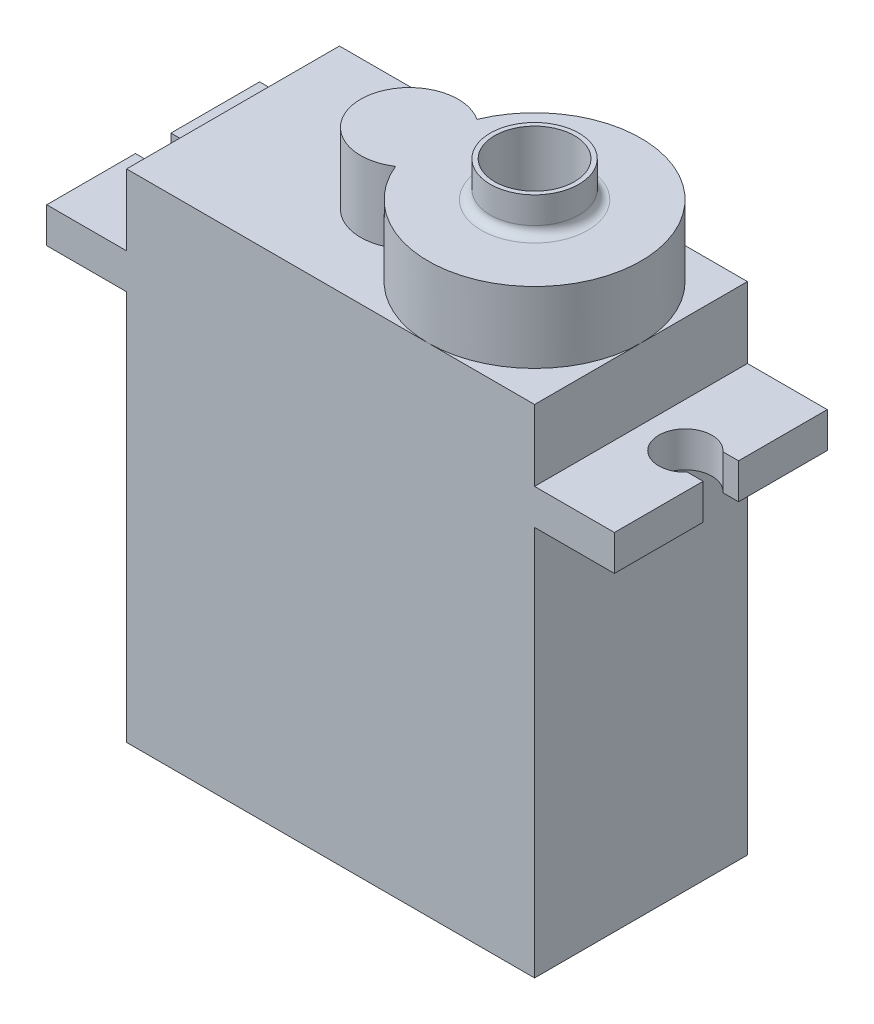
from build123d import *

# Parameters (mm, degrees)
SKETCH1_W           = 23
SKETCH1_H           = 12
BOSS_EXTRUDE1_DEPTH = 22
SKETCH2_W           = 32
SKETCH2_H           = 12
BOSS_EXTRUDE2_DEPTH = 2
CUT_EXTRUDE1_DEPTH  = 5
SKETCH3_W           = 23
SKETCH3_H           = 12
BOSS_EXTRUDE4_DEPTH = 4
BOSS_EXTRUDE5_DEPTH = 4
SKETCH6_R           = 2.5
SKETCH6_R_2         = 2.25
BOSS_EXTRUDE6_DEPTH = 2
CUT_EXTRUDE2_START  = -4
SKETCH7_R           = 2.25
CUT_EXTRUDE2_DEPTH  = 4
FILLET4_R           = 0.5
SKETCH8_R           = 2.25
BOSS_EXTRUDE7_DEPTH = 1
SKETCH9_R           = 0.75
BOSS_EXTRUDE8_DEPTH = 2


with BuildPart() as part:
    # Sketch1 → Boss-Extrude1 (new body)
    with BuildSketch(Plane(origin=(0, 0, 0), x_dir=(1, 0, 0), z_dir=(0, 1, 0))):
        Rectangle(SKETCH1_W, SKETCH1_H)
    extrude(amount=BOSS_EXTRUDE1_DEPTH)

    # Sketch2 → Boss-Extrude2 (add)
    with BuildSketch(Plane(origin=(0, 22, 0), x_dir=(1, 0, 0), z_dir=(0, 1, 0))):
        Rectangle(SKETCH2_W, SKETCH2_H)
    extrude(amount=BOSS_EXTRUDE2_DEPTH)

    # Sketch4 → Cut-Extrude1 (cut)
    with BuildSketch(Plane(origin=(0, 24, 0), x_dir=(1, 0, 0), z_dir=(0, 1, 0))):
        with BuildLine():
            Line((-16.63954717, 1), (-15.118033989, 1))
            ThreePointArc((-15.118033989, 1), (-12.5, 0), (-15.118033989, -1))
            Line((-15.118033989, -1), (-16.63954717, -1))
            Line((-16.63954717, -1), (-16.63954717, 1))
        make_face()
        with BuildLine():
            Line((15.118033989, 1), (17.121315796, 1))
            Line((17.121315796, 1), (17.121315796, -1))
            Line((17.121315796, -1), (15.118033989, -1))
            ThreePointArc((15.118033989, -1), (12.5, 0), (15.118033989, 1))
        make_face()
    extrude(amount=-CUT_EXTRUDE1_DEPTH, mode=Mode.SUBTRACT)

    # Sketch3 → Boss-Extrude4 (add)
    with BuildSketch(Plane(origin=(0, 24, 0), x_dir=(1, 0, 0), z_dir=(0, 1, 0))):
        Rectangle(SKETCH3_W, SKETCH3_H)
    extrude(amount=BOSS_EXTRUDE4_DEPTH)

    # Sketch5 → Boss-Extrude5 (add)
    with BuildSketch(Plane(origin=(0, 28, 0), x_dir=(1, 0, 0), z_dir=(0, 1, 0))):
        with BuildLine():
            ThreePointArc((-0.043232592, -2.296208273), (11.5, 0), (-0.043232592, 2.296208273))
            ThreePointArc((-0.043232592, 2.296208273), (-4.306483254, 0), (-0.043232592, -2.296208273))
        make_face()
    extrude(amount=BOSS_EXTRUDE5_DEPTH)

    # Sketch6 → Boss-Extrude6 (add)
    with BuildSketch(Plane(origin=(0, 32, 0), x_dir=(1, 0, 0), z_dir=(0, 1, 0))):
        with Locations(Location((5.5, 0, 0), (0, 0, 270))):
            Circle(SKETCH6_R)
        with Locations(Location((5.5, 0, 0), (0, 0, 270))):
            Circle(SKETCH6_R_2, mode=Mode.SUBTRACT)
    extrude(amount=BOSS_EXTRUDE6_DEPTH)

    # Sketch7 → Cut-Extrude2 (cut)
    with BuildSketch(Plane(origin=(0, 32, 0), x_dir=(1, 0, 0), z_dir=(0, 1, 0)).offset(CUT_EXTRUDE2_START)):
        with Locations(Location((5.5, 0, 0), (0, 0, 270))):
            Circle(SKETCH7_R)
    extrude(amount=CUT_EXTRUDE2_DEPTH, mode=Mode.SUBTRACT)

    # Fillet4
    fillet4_edges = [part.edges().sort_by_distance(p)[0] for p in [
        (5.5, 32, -2.5),
    ]]
    fillet(fillet4_edges, radius=FILLET4_R)

    # Sketch8 → Boss-Extrude7 (add)
    with BuildSketch(Plane(origin=(0, 0, -6), x_dir=(-1, 0, 0), z_dir=(0, 0, -1))):
        with Locations(Location((-5.5, 6, 0), (0, 0, 180))):
            Circle(SKETCH8_R)
    extrude(amount=BOSS_EXTRUDE7_DEPTH)

    # Sketch9 → Boss-Extrude8 (add)
    with BuildSketch(Plane(origin=(0, 0, -7), x_dir=(-1, 0, 0), z_dir=(0, 0, -1))):
        with Locations((-5.5, 6)):
            Circle(SKETCH9_R)
    extrude(amount=BOSS_EXTRUDE8_DEPTH)


solid = part.part
